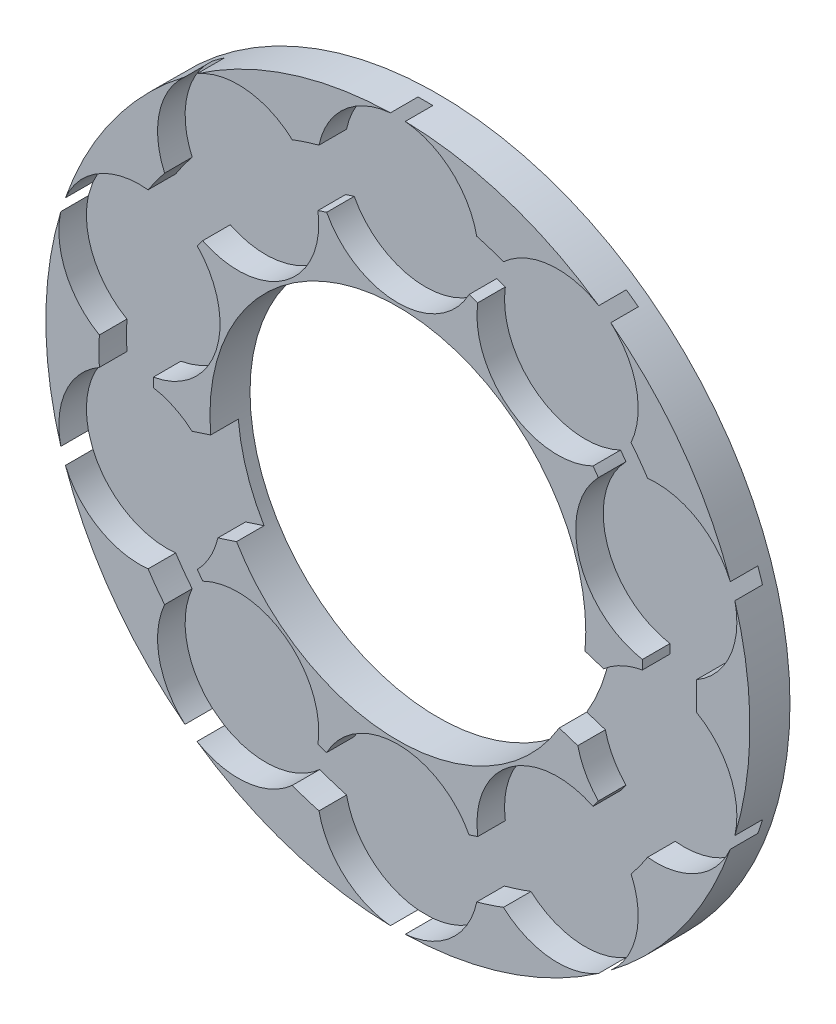
from build123d import *

# Parameters (mm, degrees)
SKETCH1_R                  = 42.14825
SKETCH1_R_2                = 22.5
BASIC_SHAPE_DEPTH          = 4.8
SKETCH2_R                  = 9.65
BATTERY_SLOT_DEPTH         = 3.3
BATTERY_SLOT_PATTERN_COUNT = 10
SKETCH3_R                  = 35.78
SKETCH3_R_2                = 29.28
BUS_SLOT_DEPTH             = 3.3
WIRE_SLIT_DEPTH            = 3.3


with BuildPart() as part:
    # Sketch1 → Basic Shape (new body)
    with BuildSketch(Plane.XY):
        Circle(SKETCH1_R)
        Circle(SKETCH1_R_2, mode=Mode.SUBTRACT)
    extrude(amount=BASIC_SHAPE_DEPTH)

    # Sketch2 → Battery Slot (cut)
    with BuildSketch(Plane.XY.offset(4.8)):
        with Locations((0, -32.53)):
            Circle(SKETCH2_R)
    battery_slot = extrude(amount=-BATTERY_SLOT_DEPTH, mode=Mode.SUBTRACT)

    # Battery Slot Pattern: Battery Slot ×10 about axis
    battery_slot_pattern_axis = Axis((0, 0, 0), (0, 0, 1))
    for i in range(1, BATTERY_SLOT_PATTERN_COUNT):
        add(battery_slot.rotate(battery_slot_pattern_axis, i * 360 / BATTERY_SLOT_PATTERN_COUNT), mode=Mode.SUBTRACT)

    # Sketch3 → Bus Slot (cut)
    with BuildSketch(Plane.XY.offset(4.8)):
        Circle(SKETCH3_R)
        Circle(SKETCH3_R_2, mode=Mode.SUBTRACT)
    extrude(amount=-BUS_SLOT_DEPTH, mode=Mode.SUBTRACT)

    # Sketch4 → Wire Slit (cut)
    with BuildSketch(Plane.XY.offset(4.8)):
        with BuildLine():
            Line((-24.633279562, -2.746526591), (-19.877996981, -1.201441619))
            Line((-19.877996981, -1.201441619), (-16.787827037, -10.712006782))
            Line((-16.787827037, -10.712006782), (-21.543109618, -12.257091754))
            ThreePointArc((-21.543109618, -12.257091754), (-21.760173093, -7.070308831), (-24.633279562, -2.746526591))
        make_face()
    wire_slit = extrude(amount=-WIRE_SLIT_DEPTH, mode=Mode.SUBTRACT)

    # Wire Slit Mirror: Wire Slit across plane
    add(wire_slit.mirror(Plane(origin=(0, 0, 0), x_dir=(0, 0, 1), z_dir=(1, 0, 0))), mode=Mode.SUBTRACT)


solid = part.part
